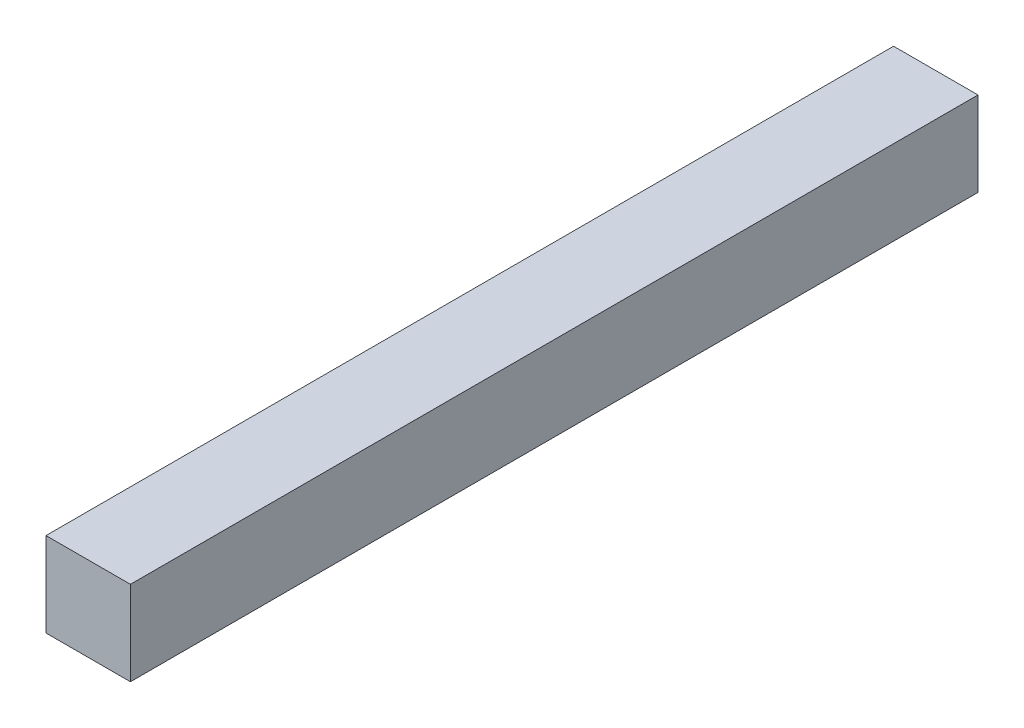
from build123d import *

# Parameters (mm, degrees)
SKETCH1_W           = 7.62
SKETCH1_H           = 7.62
BOSS_EXTRUDE1_DEPTH = 76.5048


with BuildPart() as part:
    # Sketch1 → Boss-Extrude1 (new body)
    with BuildSketch(Plane.XY.offset(35.722441806)):
        with Locations((-26.559553377, 55.646669294)):
            Rectangle(SKETCH1_W, SKETCH1_H)
    extrude(amount=BOSS_EXTRUDE1_DEPTH)


solid = part.part
